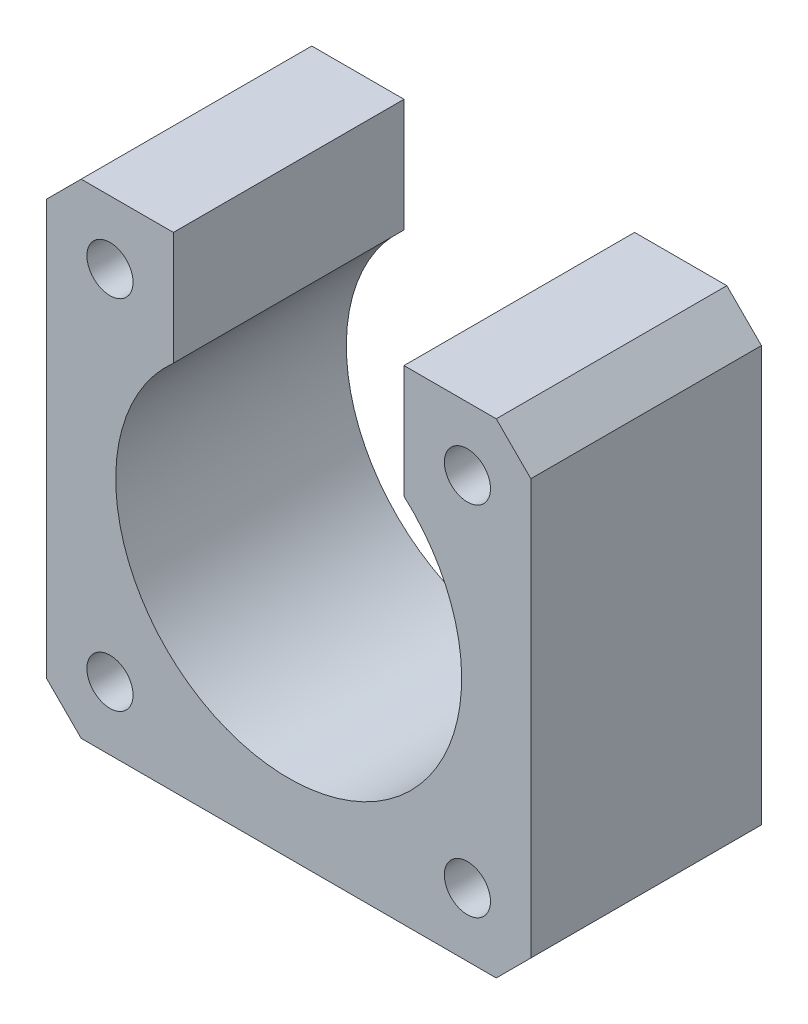
from build123d import *

# Parameters (mm, degrees)
SKETCH_1_R      = 2
EXTRUDE_1_DEPTH = 20


with BuildPart() as part:
    # 草图1 → 凸台-拉伸1 (new body)
    with BuildSketch(Plane.XY):
        with BuildLine():
            Line((-21, 18), (-18, 21))
            Line((-18, 21), (-10, 21))
            Line((-10, 21), (-10, 11.180339887))
            ThreePointArc((-10, 11.180339887), (0, -15), (10, 11.180339887))
            Line((10, 11.180339887), (10, 21))
            Line((10, 21), (18, 21))
            Line((18, 21), (21, 18))
            Line((21, 18), (21, -18))
            Line((21, -18), (18, -21))
            Line((18, -21), (-18, -21))
            Line((-18, -21), (-21, -18))
            Line((-21, -18), (-21, 18))
        make_face()
        with Locations((15.5, 15.5)):
            Circle(SKETCH_1_R, mode=Mode.SUBTRACT)
        with Locations((15.5, -15.5)):
            Circle(SKETCH_1_R, mode=Mode.SUBTRACT)
        with Locations((-15.5, -15.5)):
            Circle(SKETCH_1_R, mode=Mode.SUBTRACT)
        with Locations((-15.5, 15.5)):
            Circle(SKETCH_1_R, mode=Mode.SUBTRACT)
    extrude(amount=EXTRUDE_1_DEPTH)


solid = part.part
